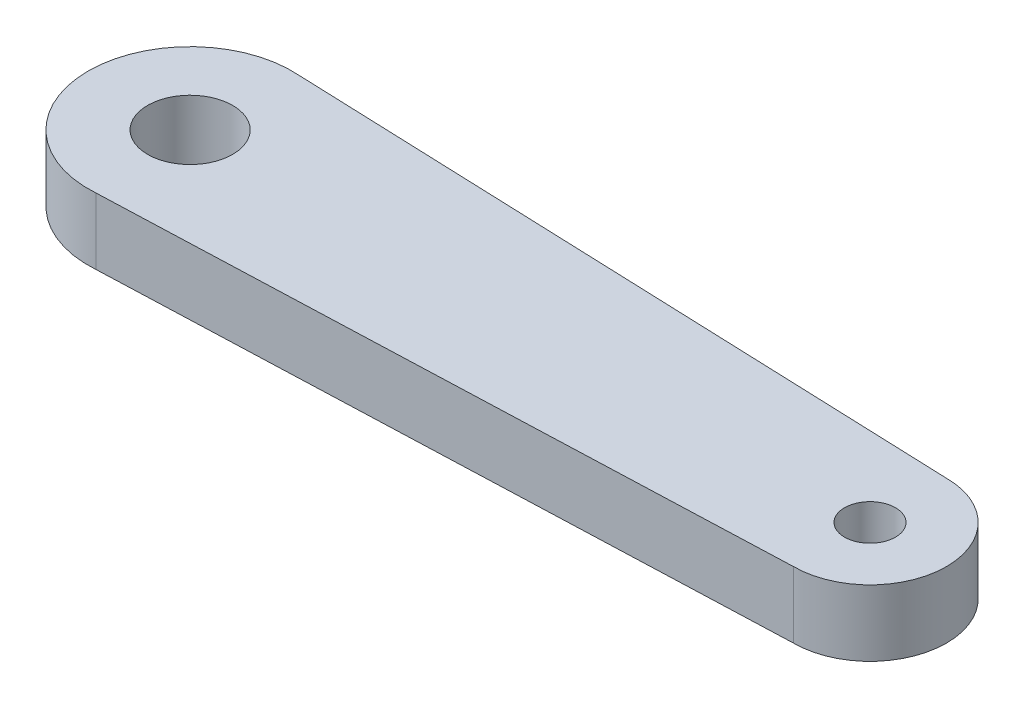
from build123d import *

# Parameters (mm, degrees)
BOSS_EXTRUDE1_DEPTH     = 3.9
CUT_EXTRUDE1_DEPTH      = 16
CUT_EXTRUDE1_DEPTH_BACK = 10.5
SKETCH2_R               = 2.5
SKETCH2_R_2             = 1.5


with BuildPart() as part:
    # Sketch1 → Boss-Extrude1 (new body)
    with BuildSketch(Plane(origin=(0, 0, 0), x_dir=(1, 0, 0), z_dir=(0, 1, 0))):
        with BuildLine():
            Line((0.449368076, 5.983148697), (40, 4.5))
            ThreePointArc((40, 4.5), (44.5, 0), (40, -4.5))
            Line((40, -4.5), (0.449368076, -5.983148697))
            ThreePointArc((0.449368076, -5.983148697), (-6, 0), (0.449368076, 5.983148697))
        make_face()
    extrude(amount=BOSS_EXTRUDE1_DEPTH)

    # Sketch2 → Cut-Extrude1 (cut, two sides: drawn at the far end of the back side and taken through both)
    with BuildSketch(Plane(origin=(0, 3.9, 0), x_dir=(1, 0, 0), z_dir=(0, 1, 0)).offset(-CUT_EXTRUDE1_DEPTH_BACK)):
        with Locations(Location((0, 0, 0), (0, 0, 270))):
            Circle(SKETCH2_R)
        with Locations(Location((40, 0, 0), (0, 0, 270))):
            Circle(SKETCH2_R_2)
    extrude(amount=CUT_EXTRUDE1_DEPTH + CUT_EXTRUDE1_DEPTH_BACK, mode=Mode.SUBTRACT)


solid = part.part
